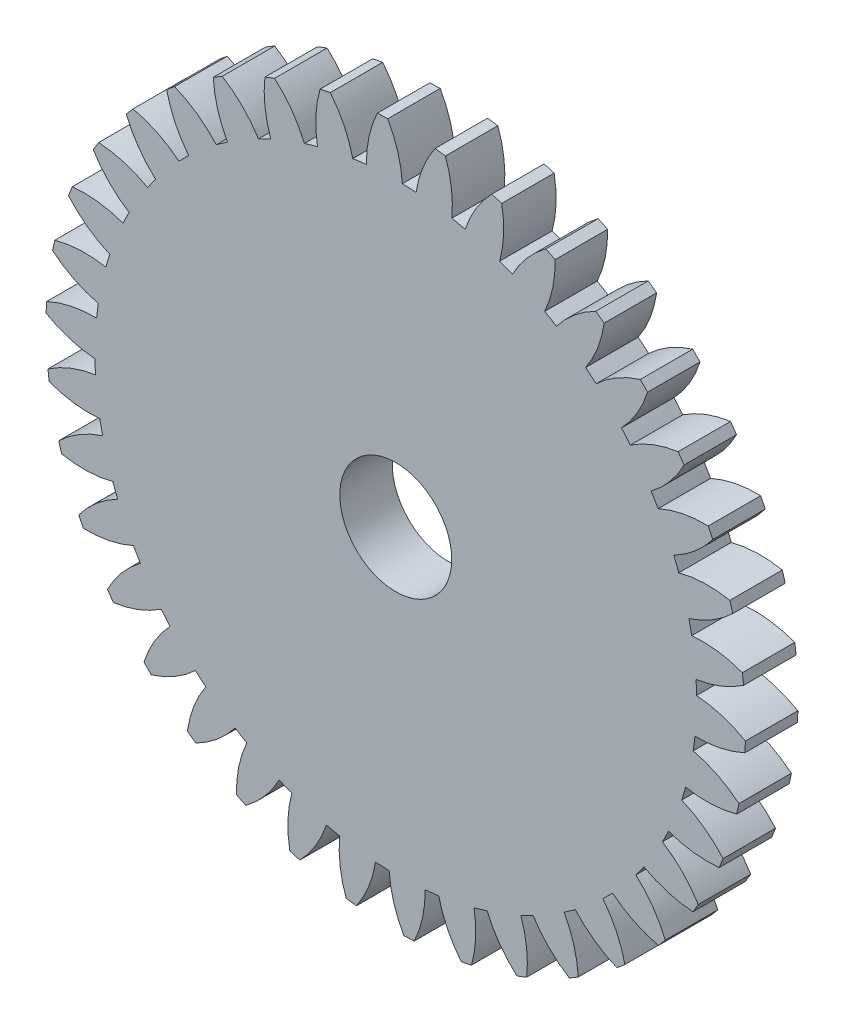
from build123d import *

# Parameters (mm, degrees)
CROQUIS2_R              = 10
CROQUIS2_R_2            = 1.6
SALIENTE_EXTRUIR1_DEPTH = 1.5
CORTAR_EXTRUIR1_DEPTH   = 1.5
MATRIZC1_COUNT          = 38


with BuildPart() as part:
    # Croquis2 → Saliente-Extruir1 (new body)
    with BuildSketch(Plane.XY):
        Circle(CROQUIS2_R)
        Circle(CROQUIS2_R_2, mode=Mode.SUBTRACT)
    extrude(amount=SALIENTE_EXTRUIR1_DEPTH)

    # Croquis1 → Cortar-Extruir1 (cut)
    with BuildSketch(Plane.XY):
        with BuildLine():
            ThreePointArc((1.122885438, 9.936756427), (0.44736663, 9.989988143), (-0.230206303, 9.997349902))
            ThreePointArc((-0.230206303, 9.997349902), (0.059173724, 9.321512358), (0.189208055, 8.597918371))
            ThreePointArc((0.189208055, 8.597918371), (0.384735302, 8.591389803), (0.580063452, 8.580415281))
            ThreePointArc((0.580063452, 8.580415281), (0.774254831, 9.289489955), (1.122885438, 9.936756427))
        make_face()
    cortar_extruir1 = extrude(amount=CORTAR_EXTRUIR1_DEPTH, mode=Mode.SUBTRACT)

    # MatrizC1: Cortar-Extruir1 ×38 about axis
    matrizc1_axis = Axis((0, 0, 0), (0, 0, 1))
    for i in range(1, MATRIZC1_COUNT):
        add(cortar_extruir1.rotate(matrizc1_axis, i * 360 / MATRIZC1_COUNT), mode=Mode.SUBTRACT)


solid = part.part
